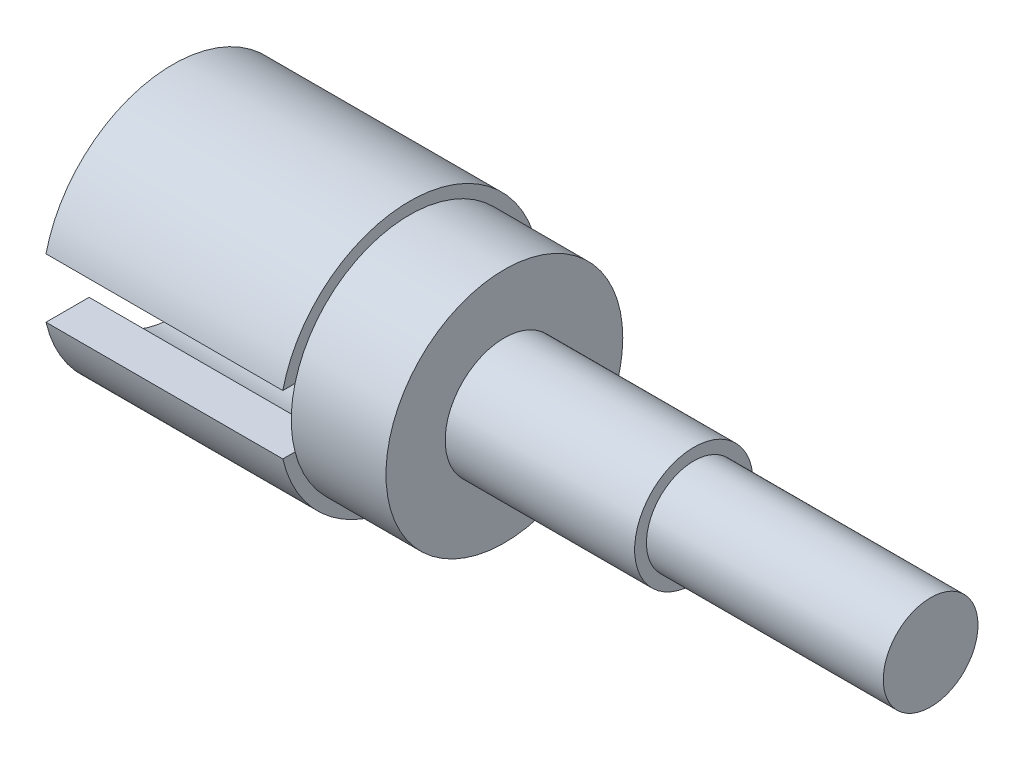
from build123d import *

# Parameters (mm, degrees)
SKETCH1_R           = 5.5
BOSS_EXTRUDE1_DEPTH = 10
SKETCH2_R           = 5
BOSS_EXTRUDE2_DEPTH = 4
SKETCH3_R           = 2.5
BOSS_EXTRUDE3_DEPTH = 8
SKETCH4_R           = 2
BOSS_EXTRUDE4_DEPTH = 10
SKETCH5_R           = 3.75
CUT_EXTRUDE1_DEPTH  = 9
SKETCH6_W           = 25.507413715
SKETCH6_H           = 2.5
CUT_EXTRUDE2_DEPTH  = 10


with BuildPart() as part:
    # Sketch1 → Boss-Extrude1 (new body)
    with BuildSketch(Plane(origin=(0, 0, 0), x_dir=(0, 0, -1), z_dir=(1, 0, 0))):
        Circle(SKETCH1_R)
    extrude(amount=BOSS_EXTRUDE1_DEPTH)

    # Sketch2 → Boss-Extrude2 (add)
    with BuildSketch(Plane(origin=(10, 0, 0), x_dir=(0, 0, -1), z_dir=(1, 0, 0))):
        Circle(SKETCH2_R)
    extrude(amount=BOSS_EXTRUDE2_DEPTH)

    # Sketch3 → Boss-Extrude3 (add)
    with BuildSketch(Plane(origin=(14, 0, 0), x_dir=(0, 0, -1), z_dir=(1, 0, 0))):
        Circle(SKETCH3_R)
    extrude(amount=BOSS_EXTRUDE3_DEPTH)

    # Sketch4 → Boss-Extrude4 (add)
    with BuildSketch(Plane(origin=(22, 0, 0), x_dir=(0, 0, -1), z_dir=(1, 0, 0))):
        Circle(SKETCH4_R)
    extrude(amount=BOSS_EXTRUDE4_DEPTH)

    # Sketch5 → Cut-Extrude1 (cut)
    with BuildSketch(Plane.ZY):
        Circle(SKETCH5_R)
    extrude(amount=-CUT_EXTRUDE1_DEPTH, mode=Mode.SUBTRACT)

    # Sketch6 → Cut-Extrude2 (cut)
    with BuildSketch(Plane.ZY):
        with Locations((1.683379731, 0)):
            Rectangle(SKETCH6_W, SKETCH6_H)
    extrude(amount=-CUT_EXTRUDE2_DEPTH, mode=Mode.SUBTRACT)


solid = part.part
